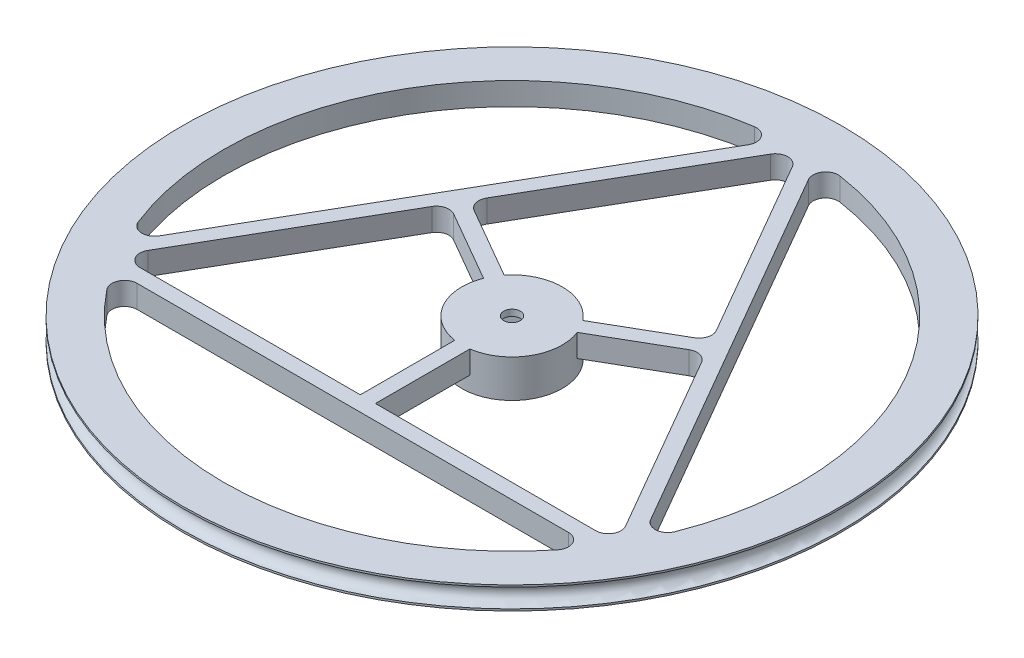
from build123d import *

# Parameters (mm, degrees)
SKETCH1_R           = 66.548
BOSS_EXTRUDE1_DEPTH = 4.572
BOSS_EXTRUDE2_START = -7.62
SKETCH2_R           = 10.16
BOSS_EXTRUDE2_DEPTH = 7.62
SKETCH3_R           = 1.6764
CUT_EXTRUDE1_DEPTH  = 7.62
CUT_EXTRUDE2_DEPTH  = 6.35
SKETCH6_R           = 1.905


with BuildPart() as part:
    # Sketch1 → Boss-Extrude1 (new body)
    with BuildSketch(Plane(origin=(0, 0, 0), x_dir=(1, 0, 0), z_dir=(0, 1, 0))):
        with Locations(Location((0, 0, 0), (0, 0, 270))):
            Circle(SKETCH1_R)
        with BuildLine():
            Line((7.937268245, 6.342347578), (22.249217727, 14.605355465))
            ThreePointArc((22.249217727, 14.605355465), (23.432669326, 16.147659616), (23.178922253, 18.07505999))
            Line((23.178922253, 18.07505999), (2.199704526, 54.412130997))
            ThreePointArc((2.199704526, 54.412130997), (0, 55.682130997), (-2.199704526, 54.412130997))
            Line((-2.199704526, 54.412130997), (-23.178922253, 18.07505999))
            ThreePointArc((-23.178922253, 18.07505999), (-23.432669326, 16.147659616), (-22.249217727, 14.605355465))
            Line((-22.249217727, 14.605355465), (-7.937268245, 6.342347578))
            ThreePointArc((-7.937268245, 6.342347578), (-8.798818102, 5.08), (-9.461268245, 3.702702148))
            Line((-9.461268245, 3.702702148), (-23.773217727, 11.965710034))
            ThreePointArc((-23.773217727, 11.965710034), (-25.700618102, 12.219457107), (-27.242922253, 11.036005508))
            Line((-27.242922253, 11.036005508), (-48.22213998, -25.301065498))
            ThreePointArc((-48.22213998, -25.301065498), (-48.22213998, -27.841065498), (-46.022435454, -29.111065498))
            Line((-46.022435454, -29.111065498), (-1.524, -29.111065498))
            Line((-1.524, -29.111065498), (-1.524, -10.045049726))
            ThreePointArc((-1.524, -10.045049726), (0, -10.16), (1.524, -10.045049726))
            Line((1.524, -10.045049726), (1.524, -29.111065498))
            Line((1.524, -29.111065498), (46.022435454, -29.111065498))
            ThreePointArc((46.022435454, -29.111065498), (48.22213998, -27.841065498), (48.22213998, -25.301065498))
            Line((48.22213998, -25.301065498), (27.242922253, 11.036005508))
            ThreePointArc((27.242922253, 11.036005508), (25.700618102, 12.219457107), (23.773217727, 11.965710034))
            Line((23.773217727, 11.965710034), (9.461268245, 3.702702148))
            ThreePointArc((9.461268245, 3.702702148), (8.798818102, 5.08), (7.937268245, 6.342347578))
        make_face(mode=Mode.SUBTRACT)
        with BuildLine():
            Line((-6.076302105, 53.793667028), (-49.624833262, -21.63460153))
            ThreePointArc((-49.624833262, -21.63460153), (-52.01382357, -22.897538736), (-54.188569544, -21.293554624))
            ThreePointArc((-54.188569544, -21.293554624), (-50.421844506, 29.111065498), (-8.653525531, 57.575455132))
            ThreePointArc((-8.653525531, 57.575455132), (-6.177061556, 56.494061928), (-6.076302105, 53.793667028))
        make_face(mode=Mode.SUBTRACT)
        with BuildLine():
            Line((-43.548531156, -32.159065498), (43.548531156, -32.159065498))
            ThreePointArc((43.548531156, -32.159065498), (45.836762015, -33.596523192), (45.535044013, -36.281900508))
            ThreePointArc((45.535044013, -36.281900508), (0, -58.222130997), (-45.535044013, -36.281900508))
            ThreePointArc((-45.535044013, -36.281900508), (-45.836762015, -33.596523192), (-43.548531156, -32.159065498))
        make_face(mode=Mode.SUBTRACT)
        with BuildLine():
            Line((49.624833262, -21.63460153), (6.076302105, 53.793667028))
            ThreePointArc((6.076302105, 53.793667028), (6.177061556, 56.494061928), (8.653525531, 57.575455132))
            ThreePointArc((8.653525531, 57.575455132), (50.421844506, 29.111065498), (54.188569544, -21.293554624))
            ThreePointArc((54.188569544, -21.293554624), (52.01382357, -22.897538736), (49.624833262, -21.63460153))
        make_face(mode=Mode.SUBTRACT)
    extrude(amount=BOSS_EXTRUDE1_DEPTH)

    # Sketch2 → Boss-Extrude2 (add)
    with BuildSketch(Plane(origin=(0, 4.572, 0), x_dir=(1, 0, 0), z_dir=(0, 1, 0)).offset(BOSS_EXTRUDE2_START)):
        with Locations(Location((0, 0, 0), (0, 0, 270))):
            Circle(SKETCH2_R)
    extrude(amount=BOSS_EXTRUDE2_DEPTH)

    # Sketch3 → Cut-Extrude1 (cut)
    with BuildSketch(Plane(origin=(0, 4.572, 0), x_dir=(1, 0, 0), z_dir=(0, 1, 0))):
        with Locations(Location((0, 0, 0), (0, 0, 270))):
            Circle(SKETCH3_R)
    extrude(amount=-CUT_EXTRUDE1_DEPTH, mode=Mode.SUBTRACT)

    # Sketch4 → Cut-Extrude2 (cut)
    with BuildSketch(Plane.XZ.offset(3.048)):
        Polygon((0, 6.858), (-5.939202219, 3.429), (-5.939202219, -3.429), (0, -6.858), (5.939202219, -3.429), (5.939202219, 3.429), align=None)
    extrude(amount=-CUT_EXTRUDE2_DEPTH, mode=Mode.SUBTRACT)

    # Sketch6 → Cut-Revolve1 (revolve, cut)
    with BuildSketch(Plane(origin=(0, 0, 0), x_dir=(0, 0, -1), z_dir=(1, 0, 0)), mode=Mode.PRIVATE) as cut_revolve1_sk:
        with Locations((66.548, 2.286)):
            Circle(SKETCH6_R)
    revolve(cut_revolve1_sk.sketch.rotate(Axis((0, 8.629088399, 0), (0, -1, 0)), 180), axis=Axis((0, 8.629088399, 0), (0, -1, 0)), mode=Mode.SUBTRACT)


solid = part.part
